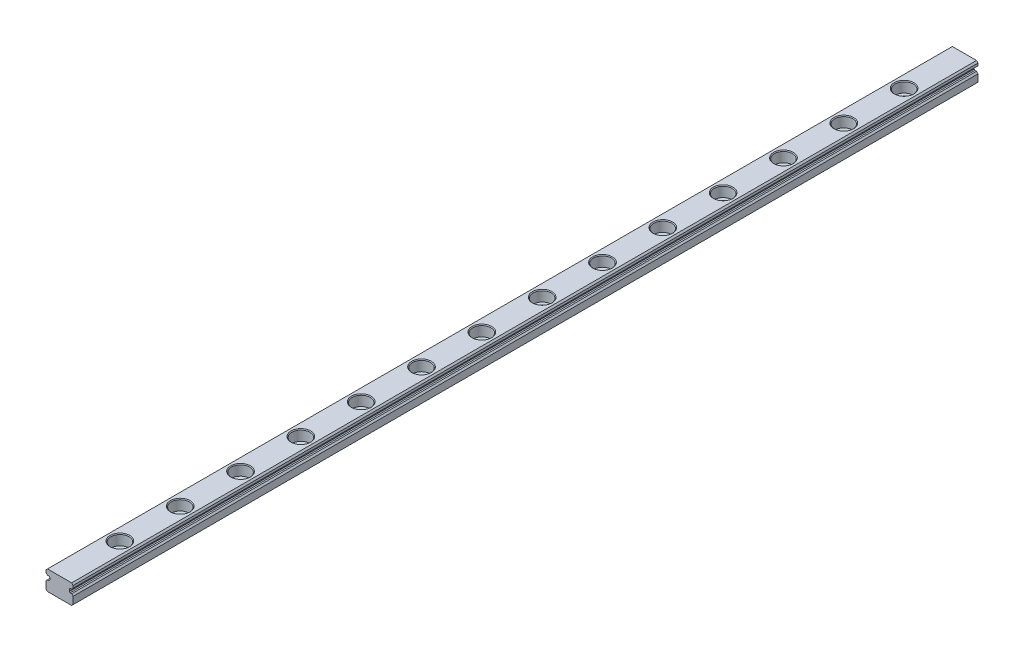
from build123d import *

# Parameters (mm, degrees)
BOSS_EXTRUDE1_DEPTH                     = 300
CBORE_FOR_M3_PAN_HEAD_SCREW1_AT_2_COUNT = 2
CBORE_FOR_M3_PAN_HEAD_SCREW1_AT_2_PITCH = 20
LPATTERN1_COUNT                         = 13
LPATTERN1_PITCH                         = 20


with BuildPart() as part:
    # Sketch1 → Boss-Extrude1 (new body)
    with BuildSketch(Plane.XY):
        Polygon((-4.005025253, 6.5), (4.005025253, 6.5), (4.5, 6.005025253), (4.5, 5.205025253), (4.005025253, 4.710050506), (3.510050506, 4.710050506), (3.25, 4.45), (3.25, 3.65), (3.510050506, 3.389949494), (4.005025253, 3.389949494), (4.5, 2.894974747), (4.5, 0.494974747), (4.005025253, 0), (-4.005025253, 0), (-4.5, 0.494974747), (-4.5, 2.894974747), (-4.005025253, 3.389949494), (-3.510050506, 3.389949494), (-3.25, 3.65), (-3.25, 4.45), (-3.510050506, 4.710050506), (-4.005025253, 4.710050506), (-4.5, 5.205025253), (-4.5, 6.005025253), align=None)
    extrude(amount=BOSS_EXTRUDE1_DEPTH)

    # Sketch3 → CBORE for M3 Pan Head Screw1 (revolve, cut)
    with BuildSketch(Plane(origin=(0, 6.5, 20), x_dir=(0, 0, 1), z_dir=(1, 0, 0))):
        Polygon((0, 0), (0, 6.5), (1.75, 6.5), (1.75, 3.5), (3, 3.5), (3, 0.25), (3.25, 0), align=None)
    cbore_for_m3_pan_head_screw1 = revolve(axis=Axis((0, 12.85, 20), (0, -1, 0)), mode=Mode.SUBTRACT)

    # CBORE for M3 Pan Head Screw1 at 2: CBORE for M3 Pan Head Screw1 ×2
    with Locations(*[(0, 0, i * CBORE_FOR_M3_PAN_HEAD_SCREW1_AT_2_PITCH) for i in range(1, CBORE_FOR_M3_PAN_HEAD_SCREW1_AT_2_COUNT)]):
        add(cbore_for_m3_pan_head_screw1, mode=Mode.SUBTRACT)

    # LPattern1: CBORE for M3 Pan Head Screw1 ×13
    with Locations(*[(0, 0, i * LPATTERN1_PITCH) for i in range(1, LPATTERN1_COUNT)]):
        add(cbore_for_m3_pan_head_screw1, mode=Mode.SUBTRACT)

    # LPattern1 copy 1 sketch → LPattern1 copy 1 (revolve, cut)
    with BuildSketch(Plane(origin=(0, 6.5, 60), x_dir=(0, 0, 1), z_dir=(1, 0, 0))):
        Polygon((0, 0), (0, 6.5), (1.75, 6.5), (1.75, 3.5), (3, 3.5), (3, 0.25), (3.25, 0), align=None)
    revolve(axis=Axis((0, 12.85, 60), (0, -1, 0)), mode=Mode.SUBTRACT)

    # LPattern1 copy 2 sketch → LPattern1 copy 2 (revolve, cut)
    with BuildSketch(Plane(origin=(0, 6.5, 80), x_dir=(0, 0, 1), z_dir=(1, 0, 0))):
        Polygon((0, 0), (0, 6.5), (1.75, 6.5), (1.75, 3.5), (3, 3.5), (3, 0.25), (3.25, 0), align=None)
    revolve(axis=Axis((0, 12.85, 80), (0, -1, 0)), mode=Mode.SUBTRACT)

    # LPattern1 copy 3 sketch → LPattern1 copy 3 (revolve, cut)
    with BuildSketch(Plane(origin=(0, 6.5, 100), x_dir=(0, 0, 1), z_dir=(1, 0, 0))):
        Polygon((0, 0), (0, 6.5), (1.75, 6.5), (1.75, 3.5), (3, 3.5), (3, 0.25), (3.25, 0), align=None)
    revolve(axis=Axis((0, 12.85, 100), (0, -1, 0)), mode=Mode.SUBTRACT)

    # LPattern1 copy 4 sketch → LPattern1 copy 4 (revolve, cut)
    with BuildSketch(Plane(origin=(0, 6.5, 120), x_dir=(0, 0, 1), z_dir=(1, 0, 0))):
        Polygon((0, 0), (0, 6.5), (1.75, 6.5), (1.75, 3.5), (3, 3.5), (3, 0.25), (3.25, 0), align=None)
    revolve(axis=Axis((0, 12.85, 120), (0, -1, 0)), mode=Mode.SUBTRACT)

    # LPattern1 copy 5 sketch → LPattern1 copy 5 (revolve, cut)
    with BuildSketch(Plane(origin=(0, 6.5, 140), x_dir=(0, 0, 1), z_dir=(1, 0, 0))):
        Polygon((0, 0), (0, 6.5), (1.75, 6.5), (1.75, 3.5), (3, 3.5), (3, 0.25), (3.25, 0), align=None)
    revolve(axis=Axis((0, 12.85, 140), (0, -1, 0)), mode=Mode.SUBTRACT)

    # LPattern1 copy 6 sketch → LPattern1 copy 6 (revolve, cut)
    with BuildSketch(Plane(origin=(0, 6.5, 160), x_dir=(0, 0, 1), z_dir=(1, 0, 0))):
        Polygon((0, 0), (0, 6.5), (1.75, 6.5), (1.75, 3.5), (3, 3.5), (3, 0.25), (3.25, 0), align=None)
    revolve(axis=Axis((0, 12.85, 160), (0, -1, 0)), mode=Mode.SUBTRACT)

    # LPattern1 copy 7 sketch → LPattern1 copy 7 (revolve, cut)
    with BuildSketch(Plane(origin=(0, 6.5, 180), x_dir=(0, 0, 1), z_dir=(1, 0, 0))):
        Polygon((0, 0), (0, 6.5), (1.75, 6.5), (1.75, 3.5), (3, 3.5), (3, 0.25), (3.25, 0), align=None)
    revolve(axis=Axis((0, 12.85, 180), (0, -1, 0)), mode=Mode.SUBTRACT)

    # LPattern1 copy 8 sketch → LPattern1 copy 8 (revolve, cut)
    with BuildSketch(Plane(origin=(0, 6.5, 200), x_dir=(0, 0, 1), z_dir=(1, 0, 0))):
        Polygon((0, 0), (0, 6.5), (1.75, 6.5), (1.75, 3.5), (3, 3.5), (3, 0.25), (3.25, 0), align=None)
    revolve(axis=Axis((0, 12.85, 200), (0, -1, 0)), mode=Mode.SUBTRACT)

    # LPattern1 copy 9 sketch → LPattern1 copy 9 (revolve, cut)
    with BuildSketch(Plane(origin=(0, 6.5, 220), x_dir=(0, 0, 1), z_dir=(1, 0, 0))):
        Polygon((0, 0), (0, 6.5), (1.75, 6.5), (1.75, 3.5), (3, 3.5), (3, 0.25), (3.25, 0), align=None)
    revolve(axis=Axis((0, 12.85, 220), (0, -1, 0)), mode=Mode.SUBTRACT)

    # LPattern1 copy 10 sketch → LPattern1 copy 10 (revolve, cut)
    with BuildSketch(Plane(origin=(0, 6.5, 240), x_dir=(0, 0, 1), z_dir=(1, 0, 0))):
        Polygon((0, 0), (0, 6.5), (1.75, 6.5), (1.75, 3.5), (3, 3.5), (3, 0.25), (3.25, 0), align=None)
    revolve(axis=Axis((0, 12.85, 240), (0, -1, 0)), mode=Mode.SUBTRACT)

    # LPattern1 copy 11 sketch → LPattern1 copy 11 (revolve, cut)
    with BuildSketch(Plane(origin=(0, 6.5, 260), x_dir=(0, 0, 1), z_dir=(1, 0, 0))):
        Polygon((0, 0), (0, 6.5), (1.75, 6.5), (1.75, 3.5), (3, 3.5), (3, 0.25), (3.25, 0), align=None)
    revolve(axis=Axis((0, 12.85, 260), (0, -1, 0)), mode=Mode.SUBTRACT)

    # LPattern1 copy 12 sketch → LPattern1 copy 12 (revolve, cut)
    with BuildSketch(Plane(origin=(0, 6.5, 280), x_dir=(0, 0, 1), z_dir=(1, 0, 0))):
        Polygon((0, 0), (0, 6.5), (1.75, 6.5), (1.75, 3.5), (3, 3.5), (3, 0.25), (3.25, 0), align=None)
    revolve(axis=Axis((0, 12.85, 280), (0, -1, 0)), mode=Mode.SUBTRACT)


solid = part.part
